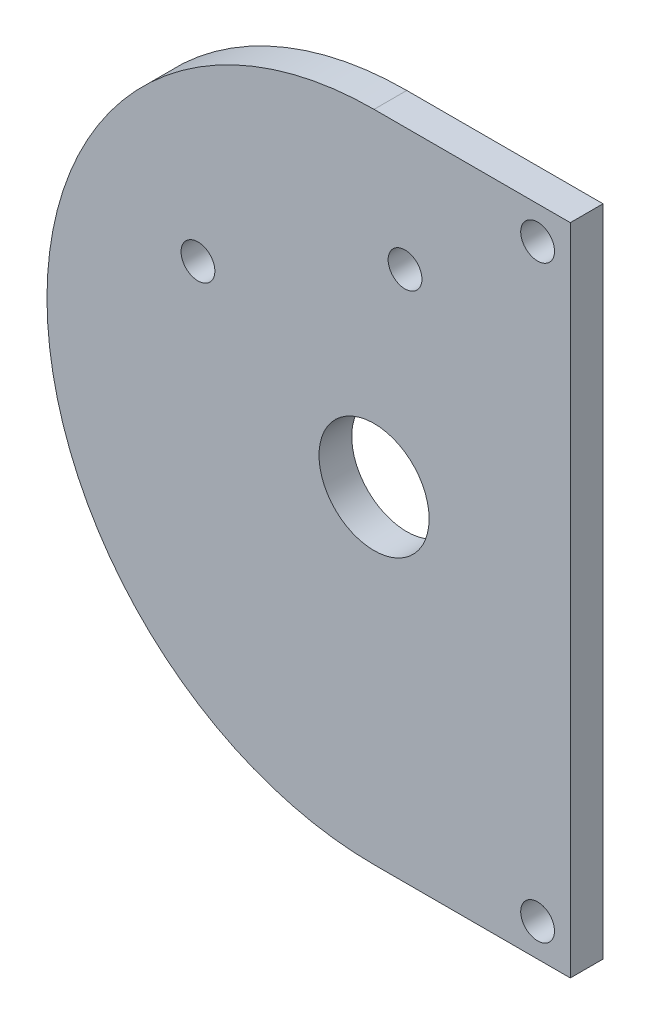
from build123d import *

# Parameters (mm, degrees)
SKETCH_1_R      = 5.05
SKETCH_1_R_2    = 1.55
EXTRUDE_1_DEPTH = 3


with BuildPart() as part:
    # ｽｹｯﾁ1 → ﾎﾞｽ - 押し出し1 (new body)
    with BuildSketch(Plane.XY):
        with BuildLine():
            Line((0, -30), (18, -30))
            Line((18, -30), (18, 30))
            Line((18, 30), (0, 30))
            ThreePointArc((0, 30), (-30, 0), (0, -30))
        make_face()
        Circle(SKETCH_1_R, mode=Mode.SUBTRACT)
        with Locations((15, 27)):
            Circle(SKETCH_1_R_2, mode=Mode.SUBTRACT)
        with Locations((15, -27)):
            Circle(SKETCH_1_R_2, mode=Mode.SUBTRACT)
        with Locations((-16.152077461, 9.846364808)):
            Circle(SKETCH_1_R_2, mode=Mode.SUBTRACT)
        with Locations((2.839602216, 18.702330483)):
            Circle(SKETCH_1_R_2, mode=Mode.SUBTRACT)
    extrude(amount=EXTRUDE_1_DEPTH)


solid = part.part
